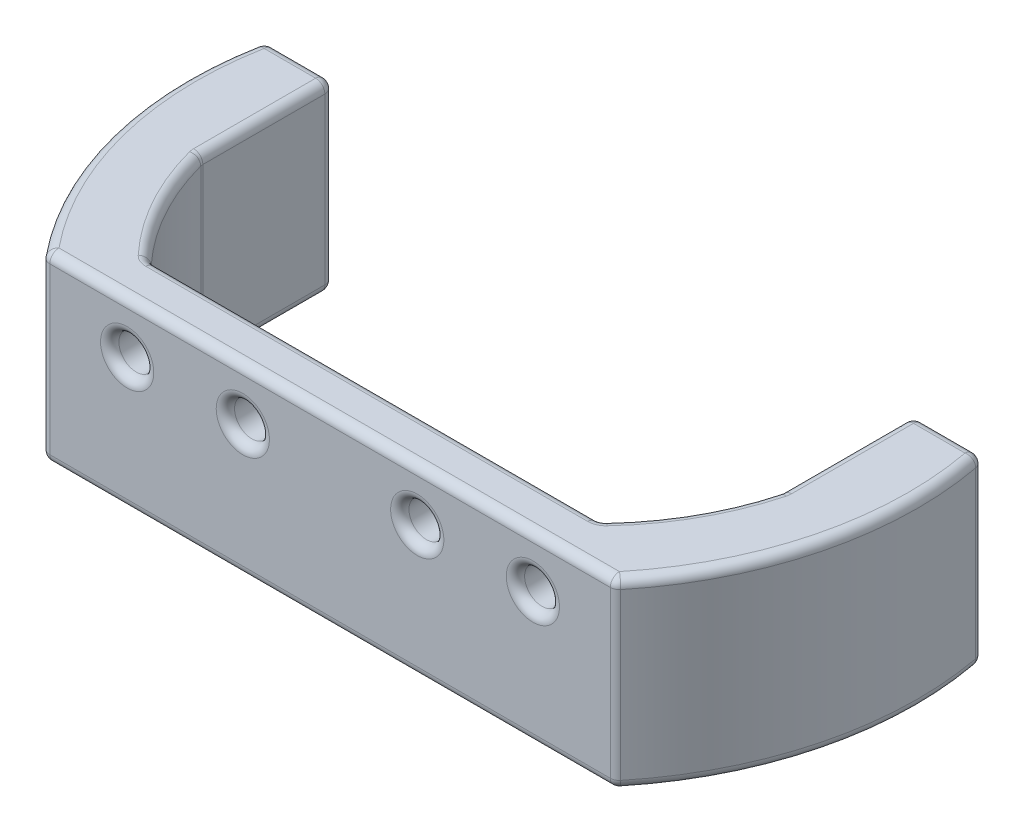
from build123d import *

# Parameters (mm, degrees)
BOSS_EXTRUDE1_DEPTH = 25.4
SKETCH2_R           = 2.413
CUT_EXTRUDE1_DEPTH  = 109.797600993
SKETCH4_R           = 1.905
CUT_EXTRUDE3_DEPTH  = 1.7526
CUT_EXTRUDE3_DRAFT  = -8
SKETCH3_R           = 1.905
CUT_EXTRUDE4_DEPTH  = 1.7526
CUT_EXTRUDE4_DRAFT  = -8
FILLET6_R           = 1.27
FILLET7_R           = 0.254


with BuildPart() as part:
    # Sketch1 → Boss-Extrude1 (new body)
    with BuildSketch(Plane(origin=(0, 0, 0), x_dir=(1, 0, 0), z_dir=(0, 1, 0))):
        with BuildLine():
            Line((10.16, -40.64), (88.9, -40.64))
            ThreePointArc((88.9, -40.64), (98.646286885, -21.486571721), (99.06, 0))
            Line((99.06, 0), (89.616807991, 0))
            Line((89.616807991, 0), (89.616807991, -18.318714474))
            ThreePointArc((89.616807991, -18.318714474), (86.158313283, -26.881500438), (80.645, -34.29))
            Line((80.645, -34.29), (18.415, -34.29))
            ThreePointArc((18.415, -34.29), (12.901686717, -26.881500438), (9.443192009, -18.318714474))
            Line((9.443192009, -18.318714474), (9.443192009, 0))
            Line((9.443192009, 0), (0, 0))
            ThreePointArc((0, 0), (0.413713115, -21.486571721), (10.16, -40.64))
        make_face()
    extrude(amount=BOSS_EXTRUDE1_DEPTH)

    # Sketch2 → Cut-Extrude1 (cut, through all)
    with BuildSketch(Plane(origin=(0, 0, 34.29), x_dir=(-1, 0, 0), z_dir=(0, 0, -1))):
        with Locations((-77.597, 18.288)):
            Circle(SKETCH2_R)
        with Locations((-21.463, 18.288)):
            Circle(SKETCH2_R)
        with Locations((-61.595, 18.288)):
            Circle(SKETCH2_R)
        with Locations((-37.465, 18.288)):
            Circle(SKETCH2_R)
    extrude(amount=-CUT_EXTRUDE1_DEPTH, mode=Mode.SUBTRACT)


with BuildPart() as cut_extrude3_tool:
    # Sketch4 → Cut-Extrude3 (with draft: the straight prism first)
    with BuildSketch(Plane(origin=(0, 0, 0), x_dir=(-1, 0, 0), z_dir=(0, 0, -1))):
        with Locations((-94.338403995, 5.08)):
            Circle(SKETCH4_R)
    extrude(amount=-CUT_EXTRUDE3_DEPTH)
    # Cut-Extrude3: the draft: its side faces are tilted about the plane it starts from
    cut_extrude3_sides = [cut_extrude3_tool.faces().sort_by_distance(p)[0] for p in [
        (96.243403995, 5.08, 0.8763),
    ]]
    draft(cut_extrude3_sides, Plane(origin=(0, 0, 0), x_dir=(-1, 0, 0), z_dir=(0, 0, -1)), CUT_EXTRUDE3_DRAFT)


with BuildPart() as part_1:
    add(part.part)

    # Cut-Extrude3: cut by cut_extrude3_tool
    add(cut_extrude3_tool.part, mode=Mode.SUBTRACT)


with BuildPart() as cut_extrude4_tool:
    # Sketch3 → Cut-Extrude4 (with draft: the straight prism first)
    with BuildSketch(Plane(origin=(0, 0, 0), x_dir=(-1, 0, 0), z_dir=(0, 0, -1))):
        with Locations((-4.721596005, 5.08)):
            Circle(SKETCH3_R)
    extrude(amount=-CUT_EXTRUDE4_DEPTH)
    # Cut-Extrude4: the draft: its side faces are tilted about the plane it starts from
    cut_extrude4_sides = [cut_extrude4_tool.faces().sort_by_distance(p)[0] for p in [
        (6.626596005, 5.08, 0.8763),
    ]]
    draft(cut_extrude4_sides, Plane(origin=(0, 0, 0), x_dir=(-1, 0, 0), z_dir=(0, 0, -1)), CUT_EXTRUDE4_DRAFT)


with BuildPart() as part_2:
    add(part_1.part)

    # Cut-Extrude4: cut by cut_extrude4_tool
    add(cut_extrude4_tool.part, mode=Mode.SUBTRACT)

    # Fillet6
    fillet6_edges = [part_2.edges().sort_by_distance(p)[0] for p in [
        (4.721596005, 0, 0),
        (9.443192009, 0, 9.159357237),
        (12.901686717, 0, 26.881500438),
        (49.53, 0, 34.29),
        (86.158313283, 0, 26.881500438),
        (89.616807991, 0, 9.159357237),
        (94.338403995, 0, 0),
        (98.646286885, 25.4, 21.486571721),
        (98.646286885, 0, 21.486571721),
        (49.53, 0, 40.64),
        (0.413713115, 0, 21.486571721),
        (94.338403995, 25.4, 0),
        (0, 12.7, 0),
        (9.443192009, 12.7, 0),
        (9.443192009, 12.7, 18.318714474),
        (18.415, 12.7, 34.29),
        (80.645, 12.7, 34.29),
        (89.616807991, 12.7, 18.318714474),
        (89.616807991, 12.7, 0),
        (99.06, 12.7, 0),
        (88.9, 12.7, 40.64),
        (10.16, 12.7, 40.64),
        (89.616807991, 25.4, 9.159357237),
        (86.158313283, 25.4, 26.881500438),
        (49.53, 25.4, 34.29),
        (12.901686717, 25.4, 26.881500438),
        (80.01, 18.288, 40.64),
        (64.008, 18.288, 40.64),
        (9.443192009, 25.4, 9.159357237),
        (39.878, 18.288, 40.64),
        (23.876, 18.288, 40.64),
        (4.721596005, 25.4, 0),
        (0.413713115, 25.4, 21.486571721),
        (49.53, 25.4, 40.64),
    ]]
    fillet(fillet6_edges, radius=FILLET6_R)

    # Fillet7
    fillet7_edges = [part_2.edges().sort_by_distance(p)[0] for p in [
        (80.01, 18.288, 34.29),
        (64.008, 18.288, 34.29),
        (39.878, 18.288, 34.29),
        (23.876, 18.288, 34.29),
        (96.243403995, 5.08, 0),
        (6.626596005, 5.08, 0),
    ]]
    fillet(fillet7_edges, radius=FILLET7_R)


solid = part_2.part
